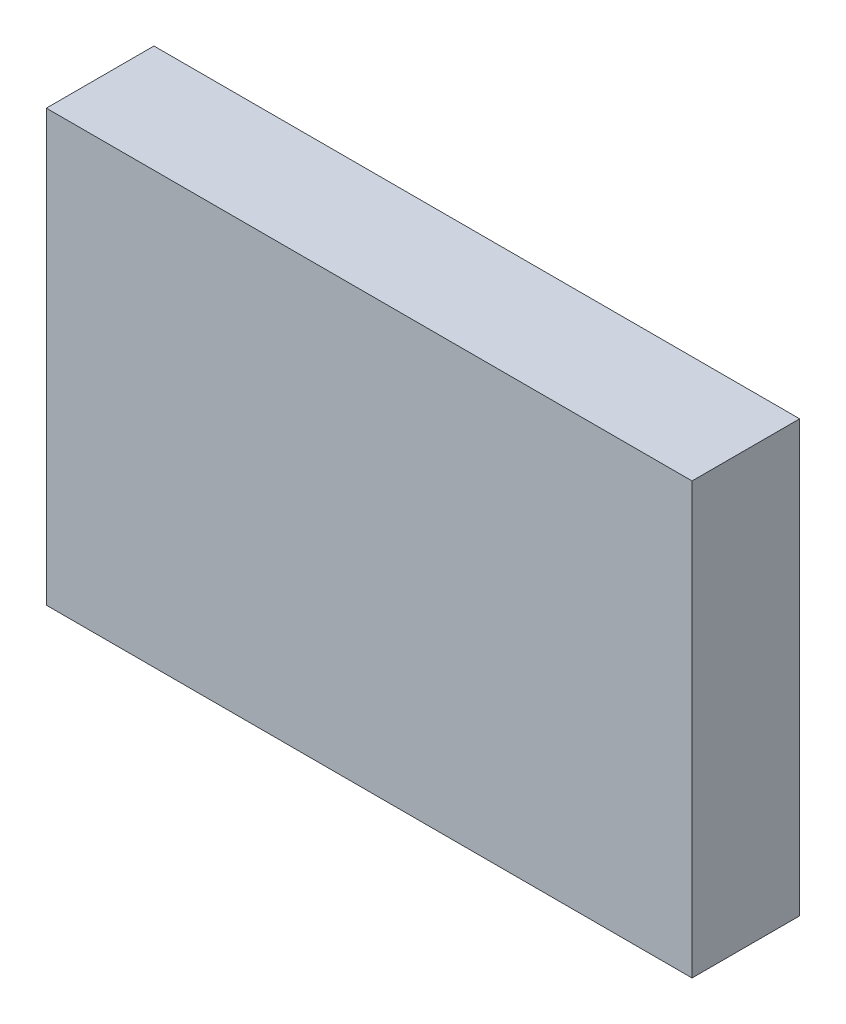
from build123d import *

# Parameters (mm, degrees)
SKETCH1_W           = 3
SKETCH1_H           = 12
BOSS_EXTRUDE1_DEPTH = 18


with BuildPart() as part:
    # Sketch1 → Boss-Extrude1 (new body)
    with BuildSketch(Plane(origin=(0, 0, 0), x_dir=(0, 0, -1), z_dir=(1, 0, 0))):
        with Locations((0.097222222, -3.229166667)):
            Rectangle(SKETCH1_W, SKETCH1_H)
    extrude(amount=BOSS_EXTRUDE1_DEPTH)


solid = part.part
